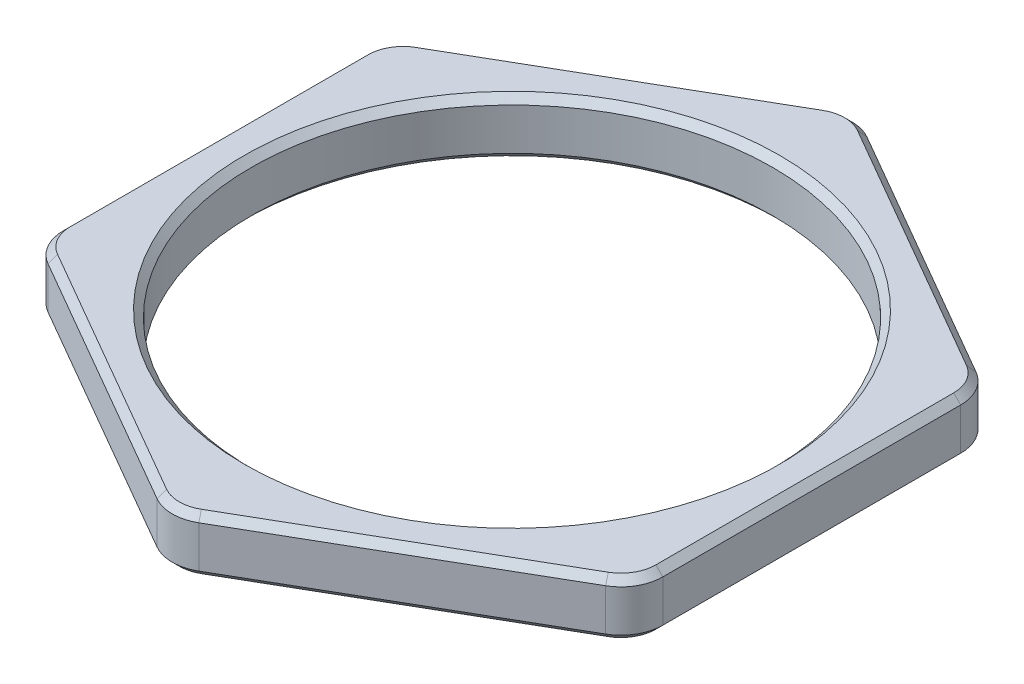
from build123d import *

# Parameters (mm, degrees)
SKETCH1_R           = 18.694950994
BOSS_EXTRUDE1_DEPTH = 4
CHAMFER1_SIZE       = 0.5


with BuildPart() as part:
    # Sketch1 → Boss-Extrude1 (new body)
    with BuildSketch(Plane(origin=(0, 0, 0), x_dir=(1, 0, 0), z_dir=(0, 1, 0))):
        with BuildLine():
            Line((-1.5, 23.960036171), (-20, 13.279056191))
            ThreePointArc((-20, 13.279056191), (-21.098076211, 12.18097998), (-21.5, 10.68097998))
            Line((-21.5, 10.68097998), (-21.5, -10.68097998))
            ThreePointArc((-21.5, -10.68097998), (-21.098076211, -12.18097998), (-20, -13.279056191))
            Line((-20, -13.279056191), (-1.5, -23.960036171))
            ThreePointArc((-1.5, -23.960036171), (0, -24.36195996), (1.5, -23.960036171))
            Line((1.5, -23.960036171), (20, -13.279056191))
            ThreePointArc((20, -13.279056191), (21.098076211, -12.18097998), (21.5, -10.68097998))
            Line((21.5, -10.68097998), (21.5, 10.68097998))
            ThreePointArc((21.5, 10.68097998), (21.098076211, 12.18097998), (20, 13.279056191))
            Line((20, 13.279056191), (1.5, 23.960036171))
            ThreePointArc((1.5, 23.960036171), (0, 24.36195996), (-1.5, 23.960036171))
        make_face()
        with Locations(Location((0, 0, 0), (0, 0, 270))):
            Circle(SKETCH1_R, mode=Mode.SUBTRACT)
    extrude(amount=BOSS_EXTRUDE1_DEPTH)

    # Chamfer1
    chamfer1_edges = [part.edges().sort_by_distance(p)[0] for p in [
        (-21.098076211, 4, -12.18097998),
        (10.75, 0, -18.619546181),
        (21.098076211, 0, -12.18097998),
        (21.5, 0, 0),
        (21.098076211, 0, 12.18097998),
        (10.75, 0, 18.619546181),
        (0, 0, 24.36195996),
        (-21.5, 4, 0),
        (-10.75, 0, 18.619546181),
        (-21.098076211, 0, 12.18097998),
        (-21.5, 0, 0),
        (-21.098076211, 0, -12.18097998),
        (-10.75, 0, -18.619546181),
        (0, 0, -24.36195996),
        (-21.098076211, 4, 12.18097998),
        (-10.75, 4, 18.619546181),
        (0, 4, 24.36195996),
        (10.75, 4, 18.619546181),
        (21.098076211, 4, 12.18097998),
        (0, 0, -18.694950994),
        (0, 4, -18.694950994),
        (21.5, 4, 0),
        (21.098076211, 4, -12.18097998),
        (10.75, 4, -18.619546181),
        (0, 4, -24.36195996),
        (-10.75, 4, -18.619546181),
    ]]
    chamfer(chamfer1_edges, length=CHAMFER1_SIZE)


solid = part.part
